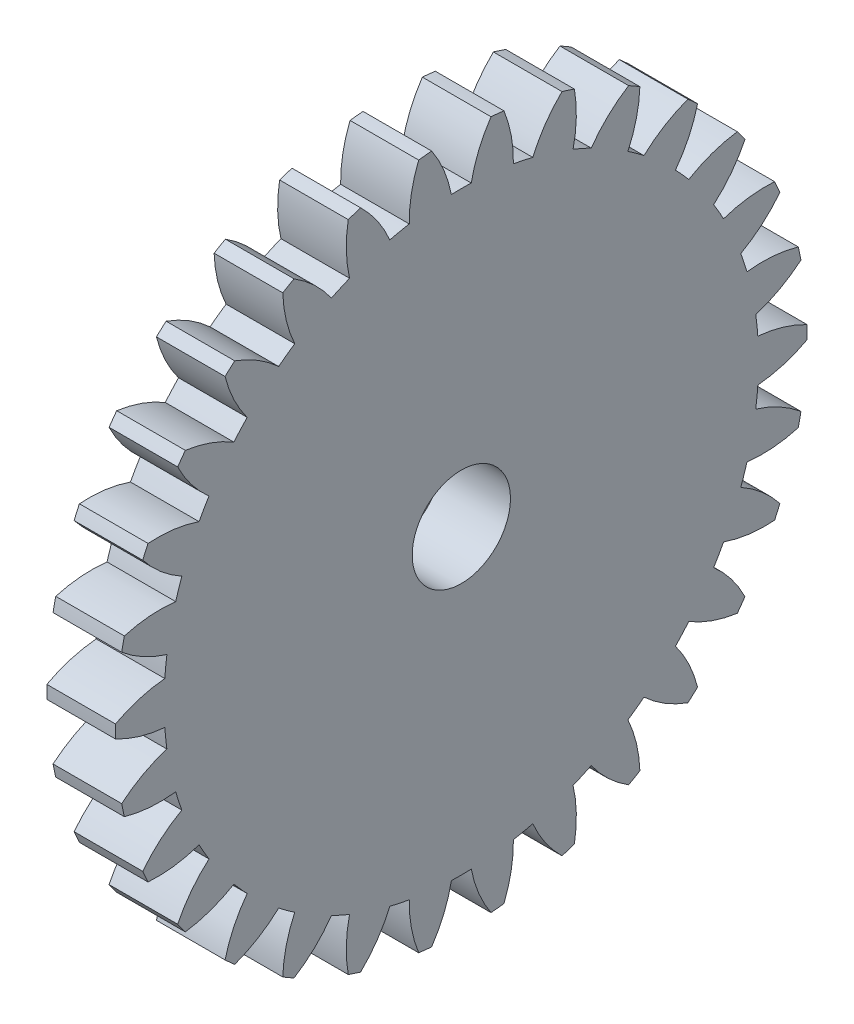
from build123d import *

# Parameters (mm, degrees)
BASPROSKE_W        = 6.35
BASPROSKE_H        = 32
TOOTHCUT_DEPTH     = 46.698167359
TEETHCUTS_COUNT    = 30
TEETHCUTS_ANGLE    = 348
BORSKE_R           = 0.4
BORE_DEPTH         = 50.0000508
SKETCH1_R          = 4.547284268
CUT_EXTRUDE1_DEPTH = 10


with BuildPart() as part:
    # BasProSke → Base-Revolve (revolve)
    with BuildSketch(Plane(origin=(0, 0, 0), x_dir=(1, 0, 0), z_dir=(0, 1, 0)), mode=Mode.PRIVATE) as base_revolve_sk:
        with Locations((3.175, 16)):
            Rectangle(BASPROSKE_W, BASPROSKE_H)
    revolve(base_revolve_sk.sketch.rotate(Axis((-10, 0, 0), (1, 0, 0)), 180), axis=Axis((-10, 0, 0), (1, 0, 0)))

    # TooCutSke → ToothCut (cut, through all)
    with BuildSketch(Plane(origin=(0, 0, 0), x_dir=(0, 0, -1), z_dir=(1, 0, 0))):
        with BuildLine():
            ThreePointArc((0.918551563, 27.483654488), (0, 27.499), (-0.918551563, 27.483654488))
            ThreePointArc((-0.918551563, 27.483654488), (-1.617208176, 29.787801627), (-2.761784709, 31.906093311))
            ThreePointArc((-2.761784709, 31.906093311), (0, 32.0254), (2.761784709, 31.906093311))
            ThreePointArc((2.761784709, 31.906093311), (1.617208176, 29.787801627), (0.918551563, 27.483654488))
        make_face()
    toothcut = extrude(amount=TOOTHCUT_DEPTH, mode=Mode.SUBTRACT)

    # TeethCuts: ToothCut ×30 about axis
    teethcuts_axis = Axis((-10, 0, 0), (1, 0, 0))
    for i in range(1, TEETHCUTS_COUNT):
        add(toothcut.rotate(teethcuts_axis, i * TEETHCUTS_ANGLE / (TEETHCUTS_COUNT - 1)), mode=Mode.SUBTRACT)

    # BorSke → Bore (cut, symmetric)
    with BuildSketch(Plane(origin=(0, 0, 0), x_dir=(0, 0, -1), z_dir=(1, 0, 0))):
        with Locations(Location((0, 0, 0), (0, 0, 180))):
            Circle(BORSKE_R)
    extrude(amount=BORE_DEPTH, both=True, mode=Mode.SUBTRACT)

    # Sketch1 → Cut-Extrude1 (cut)
    with BuildSketch(Plane(origin=(6.35, 0, 0), x_dir=(0, 0, -1), z_dir=(1, 0, 0))):
        with Locations((0, 0.4)):
            Circle(SKETCH1_R)
    extrude(amount=-CUT_EXTRUDE1_DEPTH, mode=Mode.SUBTRACT)


solid = part.part
